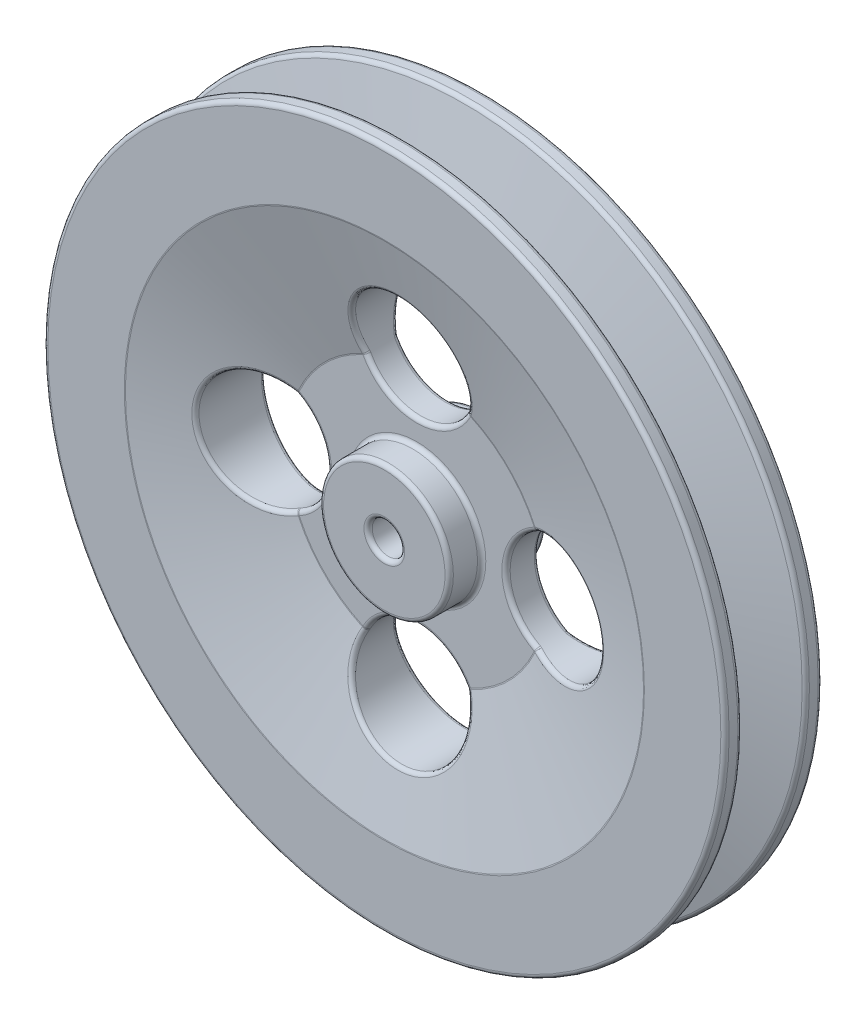
from build123d import *

# Parameters (mm, degrees)
FILLET3_R                = 0.8128
SKETCH2_R                = 11.1125
CUT_EXTRUDE1_DEPTH       = 97.19778596
FILLET4_R                = 0.8128
CIRPATTERN1_COUNT        = 4
FILLET4_OF_CIRPATTERN1_R = 0.8128


with BuildPart() as part:
    # Sketch1 → Revolve8 (revolve)
    with BuildSketch(Plane(origin=(0, 0, 0), x_dir=(1, 0, 0), z_dir=(0, 1, 0))):
        Polygon((3.175, 19.05), (3.175, 0), (12.7, 0), (12.7, 6.35), (25.4, 6.35), (50.8, 0), (66.675, 0), (66.675, 3.175), (50.8, 6.902747475), (50.8, 12.147252525), (66.675, 15.875), (66.675, 19.05), (50.8, 19.05), (25.4, 12.7), (12.7, 12.7), (12.7, 19.05), align=None)
    revolve(axis=Axis((0, 0, 0), (0, 0, -1)))

    # Fillet3
    fillet3_edges = [part.edges().sort_by_distance(p)[0] for p in [
        (-50.8, 0, -19.05),
        (-66.675, 0, -19.05),
        (-66.675, 0, -15.875),
        (-50.8, 0, -12.147252525),
        (-50.8, 0, -6.902747475),
        (-66.675, 0, -3.175),
        (-66.675, 0, 0),
        (-50.8, 0, 0),
        (-25.4, 0, -6.35),
        (-12.7, 0, -6.35),
        (-12.7, 0, 0),
        (-3.175, 0, 0),
        (-3.175, 0, -19.05),
        (-12.7, 0, -19.05),
        (-12.7, 0, -12.7),
        (-25.4, 0, -12.7),
    ]]
    fillet(fillet3_edges, radius=FILLET3_R)

    # Sketch2 → Cut-Extrude1 (cut, through all)
    with BuildSketch(Plane.XY):
        with Locations(Location((-28.575, 0, 0), (0, 0, 298.181993308))):
            Circle(SKETCH2_R)
    cut_extrude1 = extrude(amount=-CUT_EXTRUDE1_DEPTH, mode=Mode.SUBTRACT)

    # Fillet4
    fillet4_edges = [part.edges().sort_by_distance(p)[0] for p in [
        (-23.414920057, 9.841810363, -6.343915482),
        (-23.414920057, -9.841810363, -6.343915482),
        (-39.6875, 0, -16.271875),
        (-23.414920057, -9.841810363, -12.706084518),
        (-17.4625, 0, -12.7),
        (-23.414920057, 9.841810363, -12.706084518),
        (-17.4625, 0, -6.35),
        (-39.6875, 0, -2.778125),
    ]]
    fillet(fillet4_edges, radius=FILLET4_R)

    # CirPattern1: Cut-Extrude1 ×4 about axis
    cirpattern1_axis = Axis((0, 0, 0), (0, 0, 1))
    for i in range(1, CIRPATTERN1_COUNT):
        add(cut_extrude1.rotate(cirpattern1_axis, i * 360 / CIRPATTERN1_COUNT), mode=Mode.SUBTRACT)

    # Fillet4 of CirPattern1
    fillet4_of_cirpattern1_edges = [part.edges().sort_by_distance(p)[0] for p in [
        (-9.841810363, -23.414920057, -6.343915482),
        (9.841810363, -23.414920057, -6.343915482),
        (0, -39.6875, -16.271875),
        (9.841810363, -23.414920057, -12.706084518),
        (0, -17.4625, -12.7),
        (-9.841810363, -23.414920057, -12.706084518),
        (0, -17.4625, -6.35),
        (0, -39.6875, -2.778125),
        (23.414920057, -9.841810363, -6.343915482),
        (23.414920057, 9.841810363, -6.343915482),
        (39.6875, 0, -16.271875),
        (23.414920057, 9.841810363, -12.706084518),
        (17.4625, 0, -12.7),
        (23.414920057, -9.841810363, -12.706084518),
        (17.4625, 0, -6.35),
        (39.6875, 0, -2.778125),
        (9.841810363, 23.414920057, -6.343915482),
        (-9.841810363, 23.414920057, -6.343915482),
        (0, 39.6875, -16.271875),
        (-9.841810363, 23.414920057, -12.706084518),
        (0, 17.4625, -12.7),
        (9.841810363, 23.414920057, -12.706084518),
        (0, 17.4625, -6.35),
        (0, 39.6875, -2.778125),
    ]]
    fillet(fillet4_of_cirpattern1_edges, radius=FILLET4_OF_CIRPATTERN1_R)


solid = part.part
